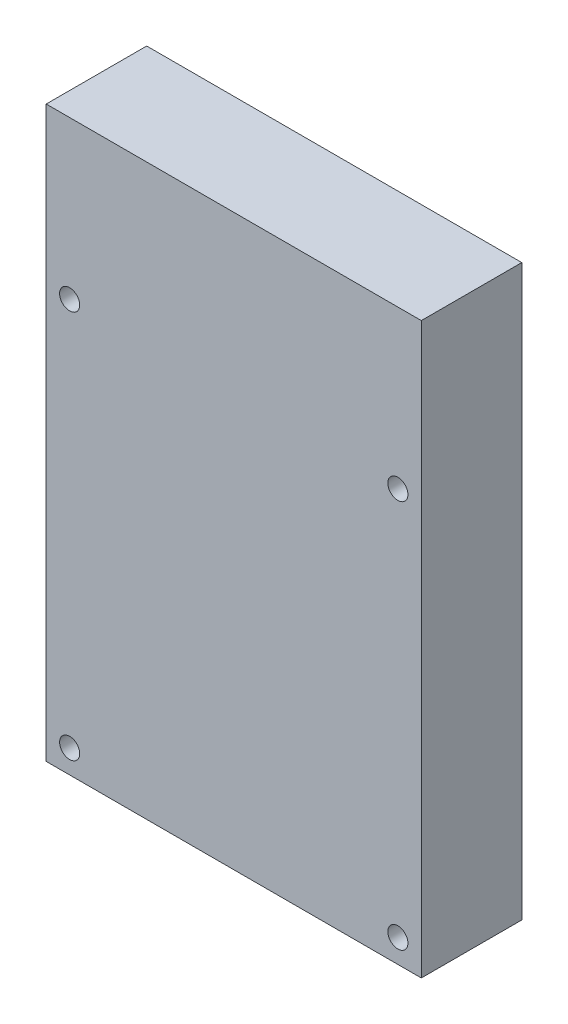
from build123d import *

# Parameters (mm, degrees)
SKETCH_1_W      = 56
SKETCH_1_H      = 85
SKETCH_1_R      = 1.5
EXTRUDE_1_DEPTH = 15


with BuildPart() as part:
    # 草图1 → 凸台-拉伸1 (new body)
    with BuildSketch(Plane.XY):
        with Locations((14.816339797, 31.886417716)):
            Rectangle(SKETCH_1_W, SKETCH_1_H)
        with Locations((-9.683660203, 50.886417716)):
            Circle(SKETCH_1_R, mode=Mode.SUBTRACT)
        with Locations((39.316339797, 50.886417716)):
            Circle(SKETCH_1_R, mode=Mode.SUBTRACT)
        with Locations((-9.683660203, -7.113582284)):
            Circle(SKETCH_1_R, mode=Mode.SUBTRACT)
        with Locations((39.316339797, -7.113582284)):
            Circle(SKETCH_1_R, mode=Mode.SUBTRACT)
    extrude(amount=EXTRUDE_1_DEPTH)


solid = part.part
